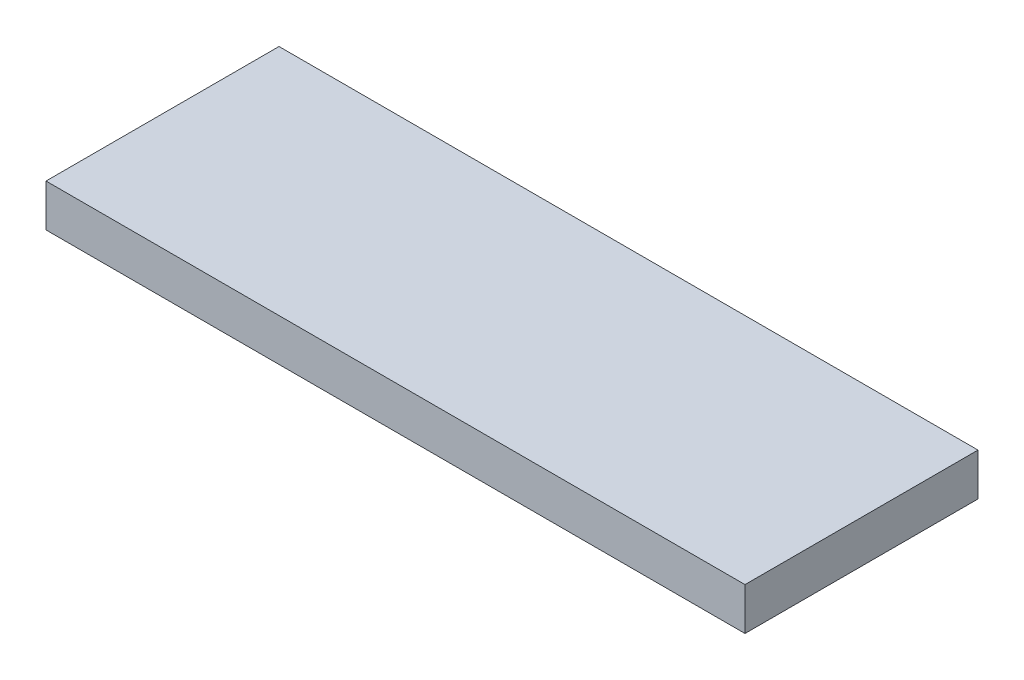
from build123d import *

# Parameters (mm, degrees)
SKETCH1_W           = 165
SKETCH1_H           = 55
BOSS_EXTRUDE1_DEPTH = 10


with BuildPart() as part:
    # Sketch1 → Boss-Extrude1 (new body)
    with BuildSketch(Plane(origin=(0, 0, 0), x_dir=(1, 0, 0), z_dir=(0, 1, 0))):
        with Locations((82.5, 27.5)):
            Rectangle(SKETCH1_W, SKETCH1_H)
    extrude(amount=BOSS_EXTRUDE1_DEPTH)


solid = part.part
